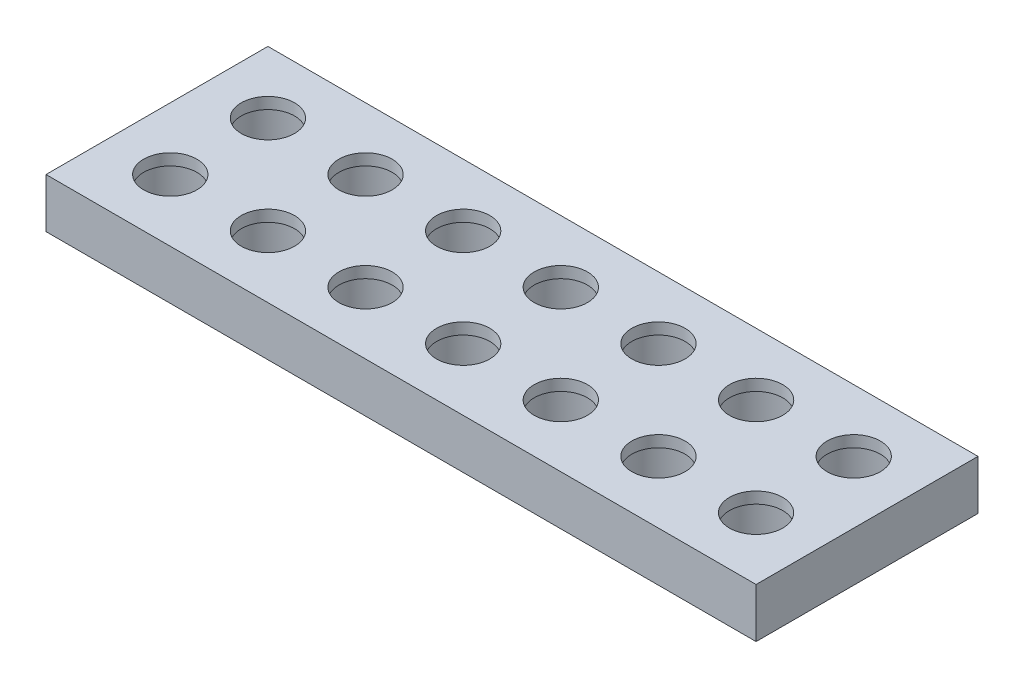
from build123d import *

# Parameters (mm, degrees)
SKETCH3_W           = 186.55
SKETCH3_H           = 58.3
SKETCH3_R           = 11.325
BOSS_EXTRUDE1_DEPTH = 10
BOSS_EXTRUDE3_START = 10
SKETCH3_5_W         = 186.55
SKETCH3_5_H         = 58.3
SKETCH3_5_R         = 7
BOSS_EXTRUDE3_DEPTH = 3


with BuildPart() as part:
    # Sketch3 → Boss-Extrude1 (new body)
    with BuildSketch(Plane(origin=(0, 0, 0), x_dir=(1, 0, 0), z_dir=(0, 1, 0))):
        with Locations((76.95, 12.825)):
            Rectangle(SKETCH3_W, SKETCH3_H)
        Circle(SKETCH3_R, mode=Mode.SUBTRACT)
        with Locations((25.65, 0)):
            Circle(SKETCH3_R, mode=Mode.SUBTRACT)
        with Locations((51.3, 0)):
            Circle(SKETCH3_R, mode=Mode.SUBTRACT)
        with Locations((76.95, 0)):
            Circle(SKETCH3_R, mode=Mode.SUBTRACT)
        with Locations((102.6, 0)):
            Circle(SKETCH3_R, mode=Mode.SUBTRACT)
        with Locations((128.25, 0)):
            Circle(SKETCH3_R, mode=Mode.SUBTRACT)
        with Locations((153.9, 0)):
            Circle(SKETCH3_R, mode=Mode.SUBTRACT)
        with Locations((0, 25.65)):
            Circle(SKETCH3_R, mode=Mode.SUBTRACT)
        with Locations((25.65, 25.65)):
            Circle(SKETCH3_R, mode=Mode.SUBTRACT)
        with Locations((51.3, 25.65)):
            Circle(SKETCH3_R, mode=Mode.SUBTRACT)
        with Locations((76.95, 25.65)):
            Circle(SKETCH3_R, mode=Mode.SUBTRACT)
        with Locations((102.6, 25.65)):
            Circle(SKETCH3_R, mode=Mode.SUBTRACT)
        with Locations((128.25, 25.65)):
            Circle(SKETCH3_R, mode=Mode.SUBTRACT)
        with Locations((153.9, 25.65)):
            Circle(SKETCH3_R, mode=Mode.SUBTRACT)
    extrude(amount=BOSS_EXTRUDE1_DEPTH)

    # Sketch3<5> → Boss-Extrude3 (add)
    with BuildSketch(Plane(origin=(0, 0, 0), x_dir=(1, 0, 0), z_dir=(0, 1, 0)).offset(BOSS_EXTRUDE3_START)):
        with Locations((76.95, 12.825)):
            Rectangle(SKETCH3_5_W, SKETCH3_5_H)
        Circle(SKETCH3_5_R, mode=Mode.SUBTRACT)
        with Locations((25.65, 0)):
            Circle(SKETCH3_5_R, mode=Mode.SUBTRACT)
        with Locations((51.3, 0)):
            Circle(SKETCH3_5_R, mode=Mode.SUBTRACT)
        with Locations((76.95, 0)):
            Circle(SKETCH3_5_R, mode=Mode.SUBTRACT)
        with Locations((102.6, 0)):
            Circle(SKETCH3_5_R, mode=Mode.SUBTRACT)
        with Locations((128.25, 0)):
            Circle(SKETCH3_5_R, mode=Mode.SUBTRACT)
        with Locations((153.9, 0)):
            Circle(SKETCH3_5_R, mode=Mode.SUBTRACT)
        with Locations((0, 25.65)):
            Circle(SKETCH3_5_R, mode=Mode.SUBTRACT)
        with Locations((25.65, 25.65)):
            Circle(SKETCH3_5_R, mode=Mode.SUBTRACT)
        with Locations((51.3, 25.65)):
            Circle(SKETCH3_5_R, mode=Mode.SUBTRACT)
        with Locations((76.95, 25.65)):
            Circle(SKETCH3_5_R, mode=Mode.SUBTRACT)
        with Locations((102.6, 25.65)):
            Circle(SKETCH3_5_R, mode=Mode.SUBTRACT)
        with Locations((128.25, 25.65)):
            Circle(SKETCH3_5_R, mode=Mode.SUBTRACT)
        with Locations((153.9, 25.65)):
            Circle(SKETCH3_5_R, mode=Mode.SUBTRACT)
    extrude(amount=BOSS_EXTRUDE3_DEPTH)


solid = part.part
